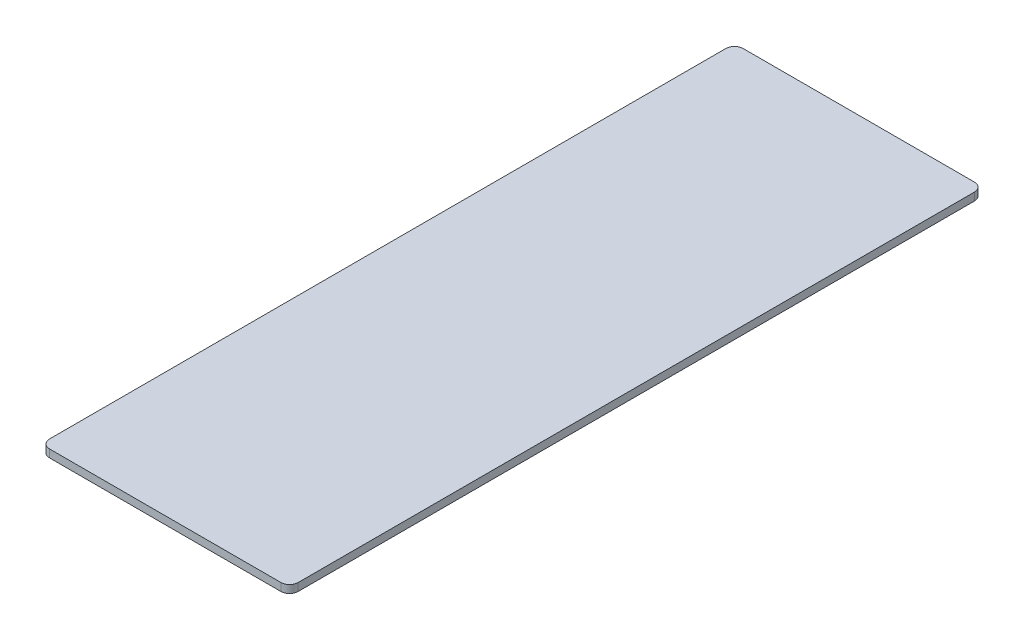
from build123d import *

# Parameters (mm, degrees)
SKETCH1_W           = 143.4
SKETCH1_H           = 400
BOSS_EXTRUDE1_DEPTH = 4.5
FILLET1_R           = 5


with BuildPart() as part:
    # Sketch1 → Boss-Extrude1 (new body)
    with BuildSketch(Plane(origin=(0, 0, 0), x_dir=(1, 0, 0), z_dir=(0, 1, 0))):
        with Locations((71.7, 200)):
            Rectangle(SKETCH1_W, SKETCH1_H)
    extrude(amount=BOSS_EXTRUDE1_DEPTH)

    # Fillet1
    fillet1_edges = [part.edges().sort_by_distance(p)[0] for p in [
        (0, 2.25, -400),
        (143.4, 2.25, -400),
        (143.4, 2.25, 0),
        (0, 2.25, 0),
    ]]
    fillet(fillet1_edges, radius=FILLET1_R)


solid = part.part
